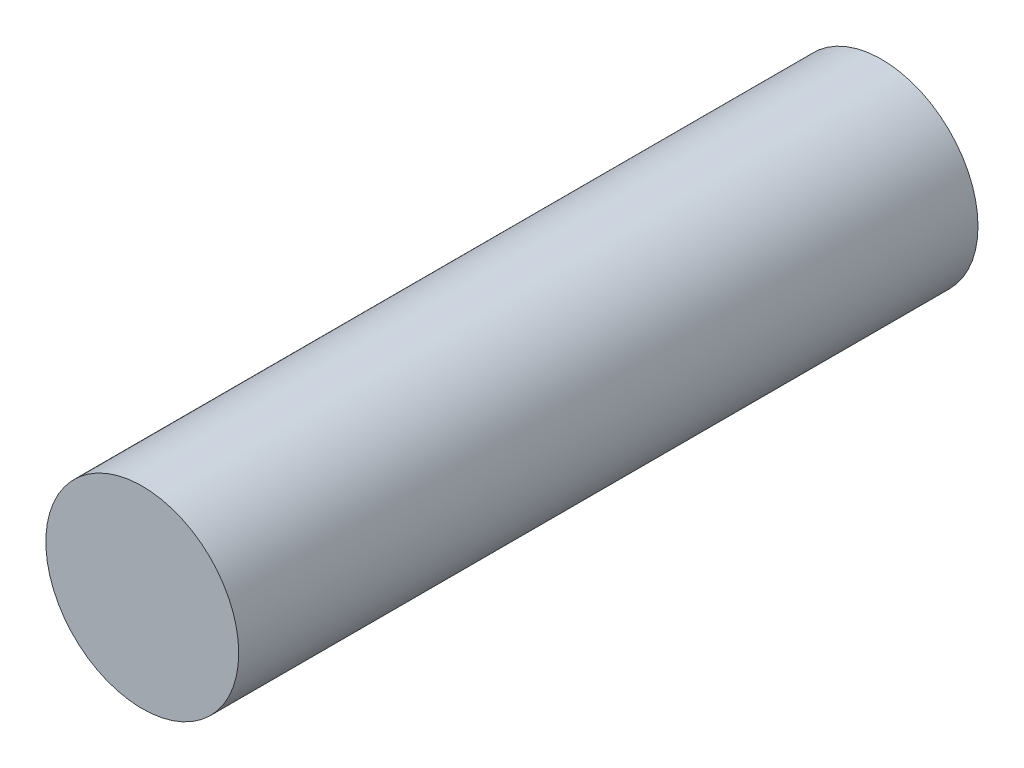
from build123d import *

# Parameters (mm, degrees)
SKETCH1_R           = 3
BOSS_EXTRUDE1_DEPTH = 23


with BuildPart() as part:
    # Sketch1 → Boss-Extrude1 (new body)
    with BuildSketch(Plane.XY):
        Circle(SKETCH1_R)
    extrude(amount=BOSS_EXTRUDE1_DEPTH)


solid = part.part
